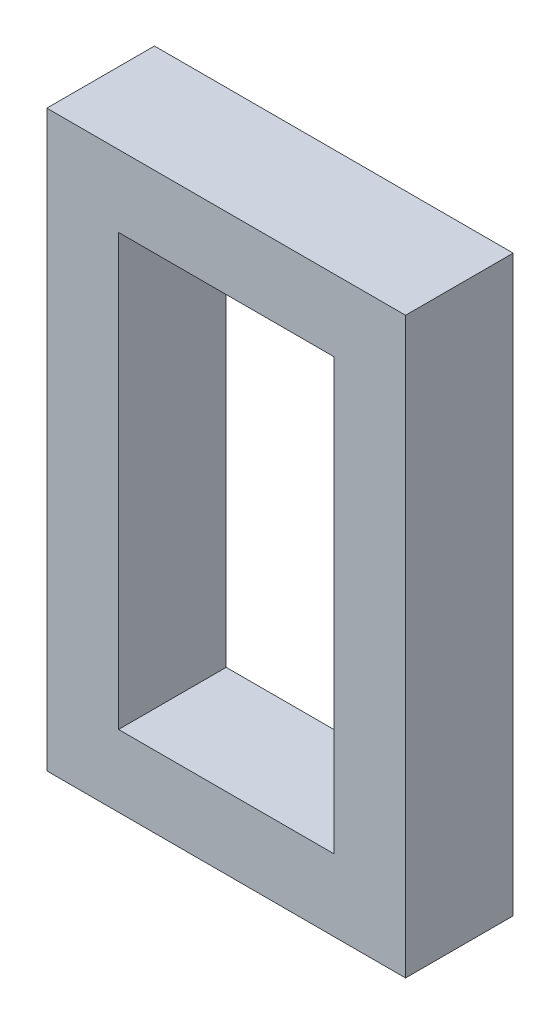
from build123d import *

# Parameters (mm, degrees)
SKETCH1_W     = 10
SKETCH1_H     = 16
SKETCH1_W_2   = 6
SKETCH1_H_2   = 12
PROFILE_DEPTH = 3


with BuildPart() as part:
    # Sketch1 → Profile (new body)
    with BuildSketch(Plane.XY):
        with Locations((5, 8)):
            Rectangle(SKETCH1_W, SKETCH1_H)
        with Locations((5, 8)):
            Rectangle(SKETCH1_W_2, SKETCH1_H_2, mode=Mode.SUBTRACT)
    extrude(amount=PROFILE_DEPTH)


solid = part.part
